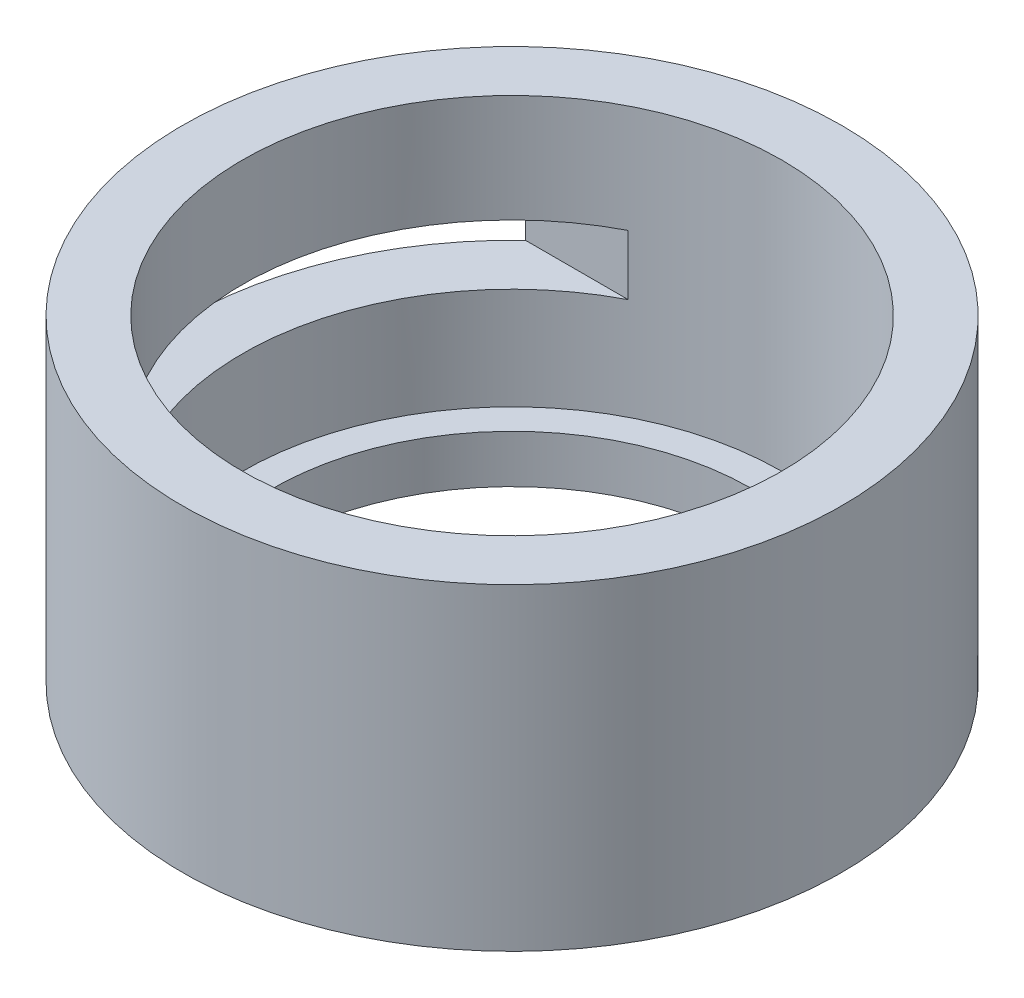
from build123d import *

# Parameters (mm, degrees)
SKETCH2_W          = 80
SKETCH2_H          = 10
CUT_EXTRUDE1_DEPTH = 39


with BuildPart() as part:
    # Sketch1 → Revolve1 (revolve)
    with BuildSketch(Plane.XY):
        Polygon((40, 7.915215599), (55, 7.915215599), (55, 60.915215599), (45, 60.915215599), (45, 15.915215599), (40, 15.915215599), align=None)
    revolve(axis=Axis((0, 0, 0), (0, 1, 0)))

    # Sketch2 → Cut-Extrude1 (cut)
    with BuildSketch(Plane.ZY.offset(55)):
        with Locations((0, 37.915215599)):
            Rectangle(SKETCH2_W, SKETCH2_H)
    extrude(amount=-CUT_EXTRUDE1_DEPTH, mode=Mode.SUBTRACT)


solid = part.part
